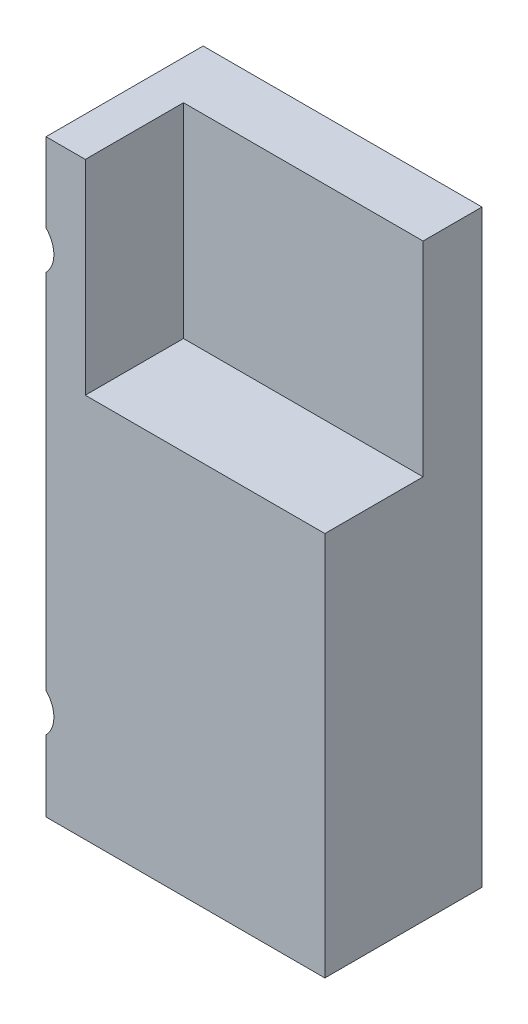
from build123d import *

# Parameters (mm, degrees)
SKETCH1_W           = 18.034
SKETCH1_H           = 38.1
BOSS_EXTRUDE1_DEPTH = 3.81
SKETCH2_W           = 2.54
SKETCH2_H           = 38.1
SKETCH2_H_2         = 24.892
BOSS_EXTRUDE2_DEPTH = 6.35
SKETCH4_W           = 12.954
SKETCH4_H           = 3.17934121
BOSS_EXTRUDE4_DEPTH = 6.35
SKETCH6_R           = 1.778
CUT_EXTRUDE1_DEPTH  = 12.192
SKETCH7_W           = 12.954
SKETCH7_H           = 21.71265879
BOSS_EXTRUDE5_DEPTH = 6.35


with BuildPart() as part:
    # Sketch1 → Boss-Extrude1 (new body)
    with BuildSketch(Plane.XY):
        with Locations((1.952722402, -9.352060056)):
            Rectangle(SKETCH1_W, SKETCH1_H)
    extrude(amount=BOSS_EXTRUDE1_DEPTH)

    # Sketch2 → Boss-Extrude2 (add)
    with BuildSketch(Plane.XY.offset(3.81)):
        with Locations((-5.794277598, -9.352060056)):
            Rectangle(SKETCH2_W, SKETCH2_H)
        with Locations((9.699722402, -15.956060056)):
            Rectangle(SKETCH2_W, SKETCH2_H_2)
    extrude(amount=BOSS_EXTRUDE2_DEPTH)

    # Sketch4 → Boss-Extrude4 (add)
    with BuildSketch(Plane.XY.offset(3.81)):
        with Locations((1.952722402, -5.099730661)):
            Rectangle(SKETCH4_W, SKETCH4_H)
    extrude(amount=BOSS_EXTRUDE4_DEPTH)

    # Sketch6 → Cut-Extrude1 (cut)
    with BuildSketch(Plane.XY):
        with Locations((-8.334277598, 3.347939944)):
            Circle(SKETCH6_R)
        with Locations((-8.334277598, -22.560060056)):
            Circle(SKETCH6_R)
    extrude(amount=CUT_EXTRUDE1_DEPTH, mode=Mode.SUBTRACT)

    # Sketch7 → Boss-Extrude5 (add)
    with BuildSketch(Plane.XY.offset(3.81)):
        with Locations((1.952722402, -17.545730661)):
            Rectangle(SKETCH7_W, SKETCH7_H)
    extrude(amount=BOSS_EXTRUDE5_DEPTH)


solid = part.part
